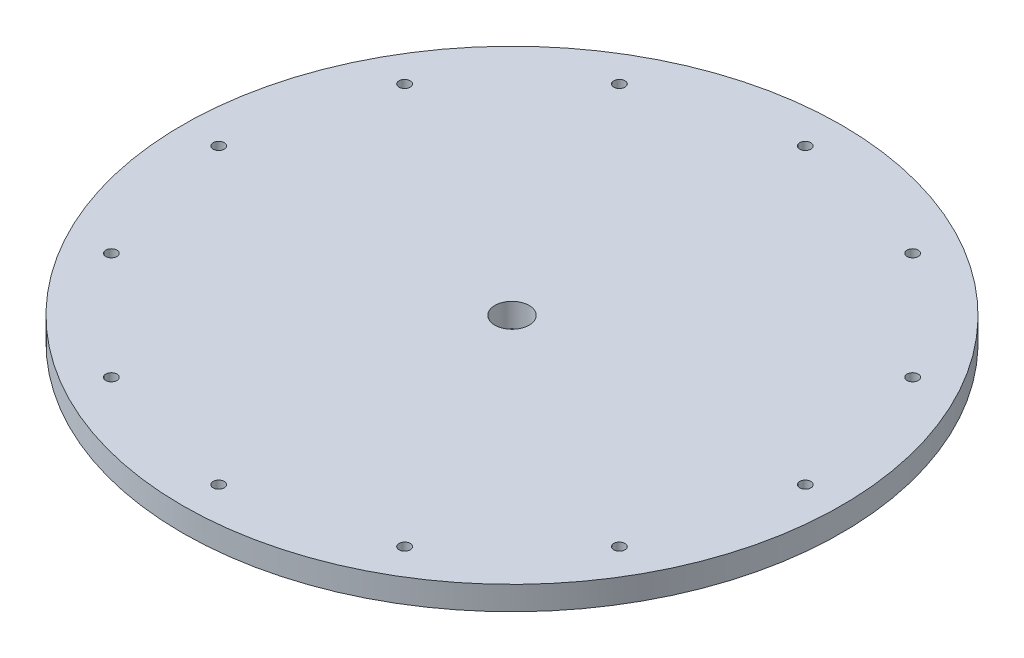
from build123d import *

# Parameters (mm, degrees)
SKETCH1_R           = 250
SKETCH1_R_2         = 4.25
SKETCH1_R_3         = 13
BOSS_EXTRUDE1_DEPTH = 9


with BuildPart() as part:
    # Sketch1 → Boss-Extrude1 (new, symmetric)
    with BuildSketch(Plane(origin=(0, 0, 0), x_dir=(1, 0, 0), z_dir=(0, 1, 0))):
        with Locations(Location((0, 0, 0), (0, 0, 270))):
            Circle(SKETCH1_R)
        with Locations(Location((0, 222.5, 0), (0, 0, 270))):
            Circle(SKETCH1_R_2, mode=Mode.SUBTRACT)
        with Locations(Location((111.25, 192.690652342, 0), (0, 0, 270))):
            Circle(SKETCH1_R_2, mode=Mode.SUBTRACT)
        with Locations(Location((192.690652342, 111.25, 0), (0, 0, 270))):
            Circle(SKETCH1_R_2, mode=Mode.SUBTRACT)
        with Locations(Location((222.5, 0, 0), (0, 0, 270))):
            Circle(SKETCH1_R_2, mode=Mode.SUBTRACT)
        with Locations(Location((192.690652342, -111.25, 0), (0, 0, 270))):
            Circle(SKETCH1_R_2, mode=Mode.SUBTRACT)
        with Locations(Location((111.25, -192.690652342, 0), (0, 0, 270))):
            Circle(SKETCH1_R_2, mode=Mode.SUBTRACT)
        with Locations(Location((0, 0, 0), (0, 0, 270))):
            Circle(SKETCH1_R_3, mode=Mode.SUBTRACT)
        with Locations(Location((0, -222.5, 0), (0, 0, 270))):
            Circle(SKETCH1_R_2, mode=Mode.SUBTRACT)
        with Locations(Location((-111.25, -192.690652342, 0), (0, 0, 270))):
            Circle(SKETCH1_R_2, mode=Mode.SUBTRACT)
        with Locations(Location((-192.690652342, -111.25, 0), (0, 0, 270))):
            Circle(SKETCH1_R_2, mode=Mode.SUBTRACT)
        with Locations(Location((-222.5, 0, 0), (0, 0, 270))):
            Circle(SKETCH1_R_2, mode=Mode.SUBTRACT)
        with Locations(Location((-192.690652342, 111.25, 0), (0, 0, 270))):
            Circle(SKETCH1_R_2, mode=Mode.SUBTRACT)
        with Locations(Location((-111.25, 192.690652342, 0), (0, 0, 270))):
            Circle(SKETCH1_R_2, mode=Mode.SUBTRACT)
    extrude(amount=BOSS_EXTRUDE1_DEPTH, both=True)


solid = part.part
